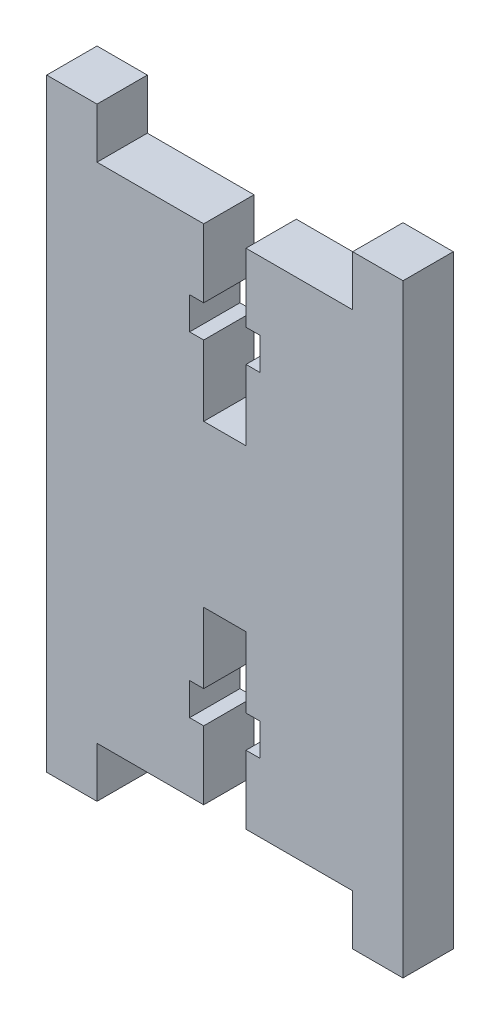
from build123d import *

# Parameters (mm, degrees)
BOSS_EXTRUDE1_DEPTH = 5


with BuildPart() as part:
    # Sketch1 → Boss-Extrude1 (new body)
    with BuildSketch(Plane.XY):
        Polygon((-35.4, 55), (-35.4, -5), (-30.4, -5), (-30.4, 0), (-19.8, 0), (-19.8, 6.8), (-21.2, 6.8), (-21.2, 10), (-19.8, 10), (-19.8, 17), (-15.6, 17), (-15.6, 10), (-14.2, 10), (-14.2, 6.8), (-15.6, 6.8), (-15.6, 0), (-5, 0), (-5, -5), (0, -5), (0, 55), (-5, 55), (-5, 50), (-15.6, 50), (-15.6, 43.2), (-14.2, 43.2), (-14.2, 40), (-15.6, 40), (-15.6, 33), (-19.8, 33), (-19.8, 40), (-21.2, 40), (-21.2, 43.2), (-19.8, 43.2), (-19.8, 50), (-30.4, 50), (-30.4, 55), align=None)
    extrude(amount=BOSS_EXTRUDE1_DEPTH)


solid = part.part
